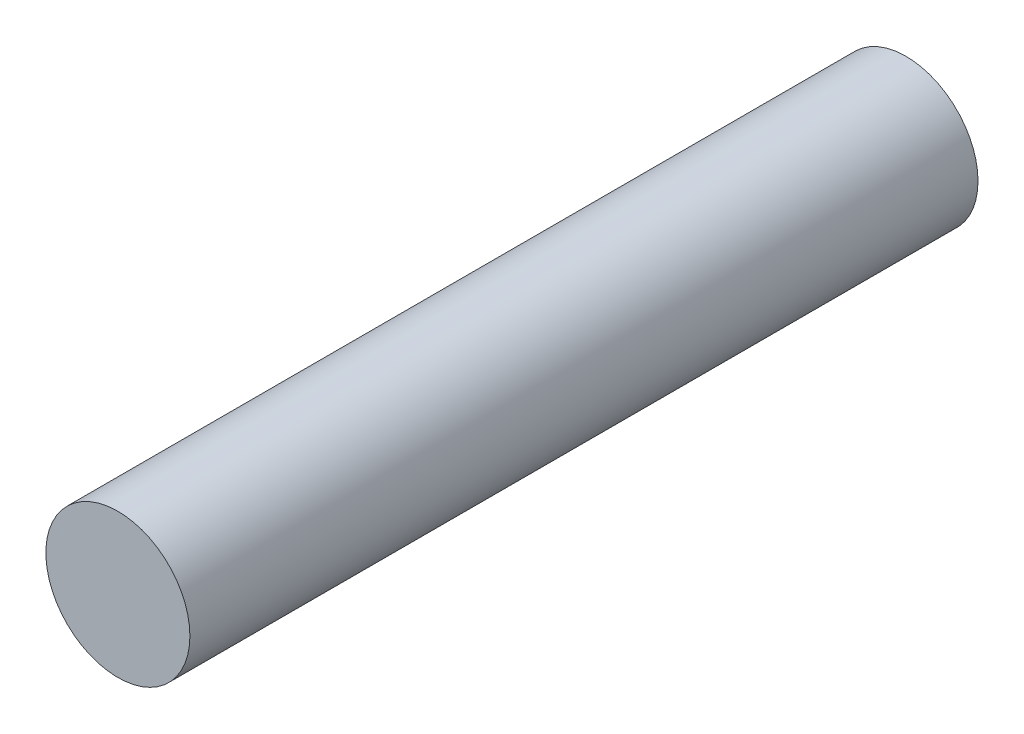
from build123d import *

# Parameters (mm, degrees)
SKETCH1_R           = 4.1783
BOSS_EXTRUDE1_DEPTH = 45.72


with BuildPart() as part:
    # Sketch1 → Boss-Extrude1 (new body)
    with BuildSketch(Plane.XY):
        Circle(SKETCH1_R)
    extrude(amount=BOSS_EXTRUDE1_DEPTH)


solid = part.part
